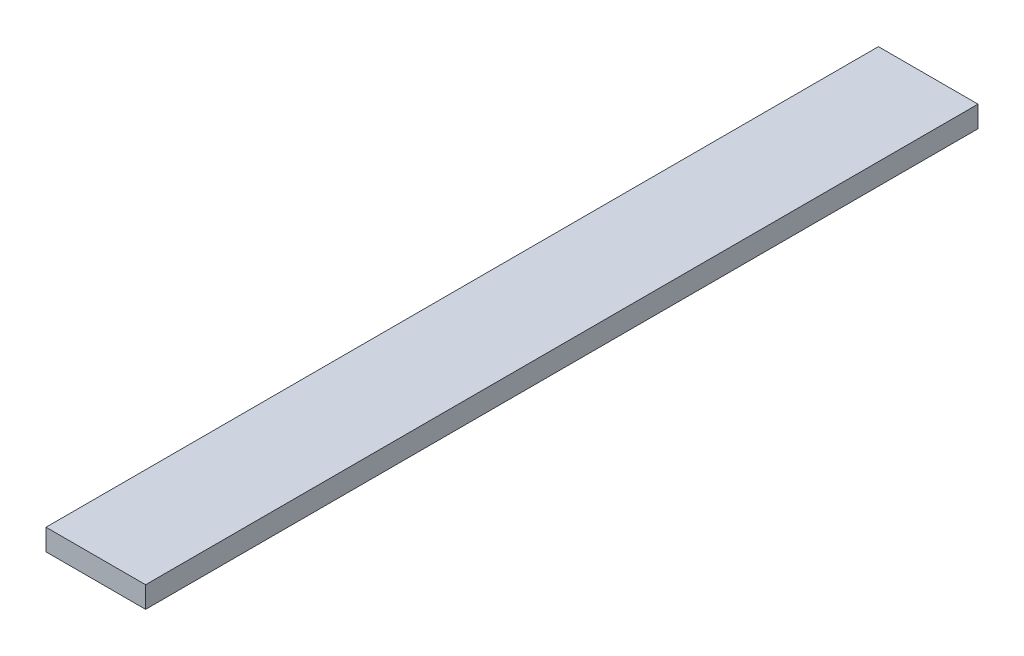
from build123d import *

# Parameters (mm, degrees)
ESBO_O1_W                = 70
ESBO_O1_H                = 15
RESSALTO_EXTRUS_O1_DEPTH = 585


with BuildPart() as part:
    # Esboço1 → Ressalto-extrusão1 (new body)
    with BuildSketch(Plane.XY):
        Rectangle(ESBO_O1_W, ESBO_O1_H)
    extrude(amount=RESSALTO_EXTRUS_O1_DEPTH)


solid = part.part
